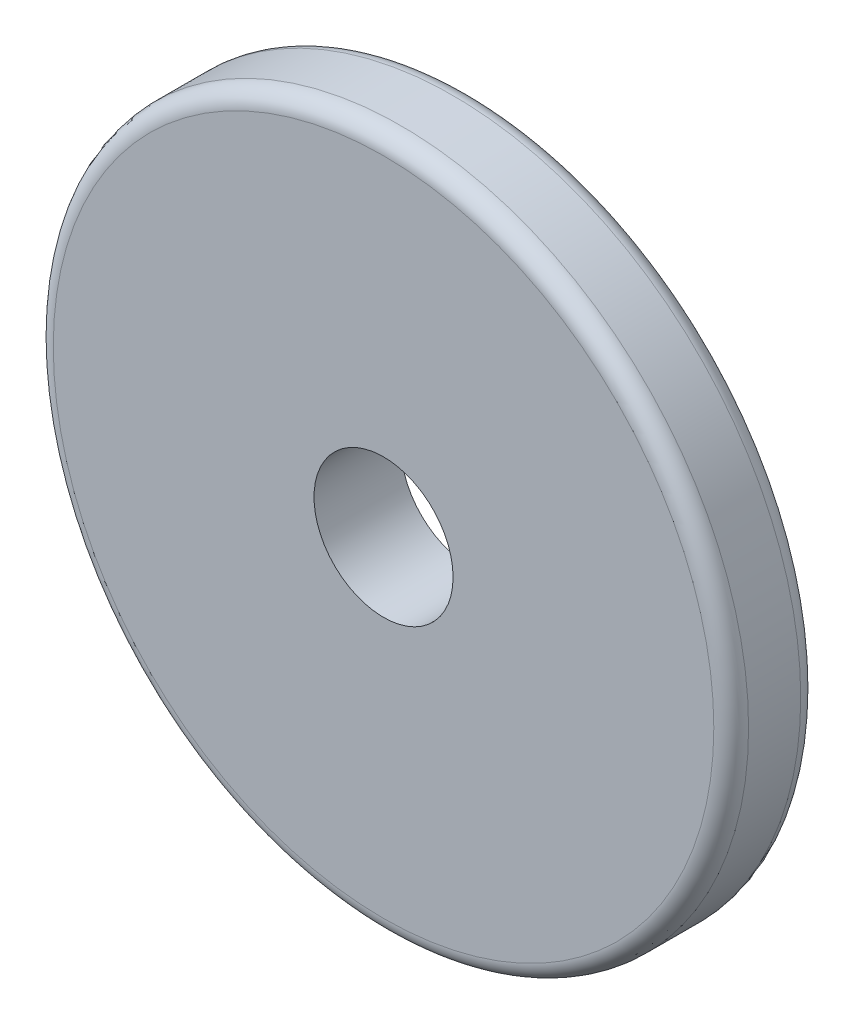
from build123d import *

# Parameters (mm, degrees)
SKETCH1_R           = 20
SKETCH1_R_2         = 4
BOSS_EXTRUDE1_DEPTH = 5
FILLET1_R           = 1


with BuildPart() as part:
    # Sketch1 → Boss-Extrude1 (new body)
    with BuildSketch(Plane.XY):
        Circle(SKETCH1_R)
        Circle(SKETCH1_R_2, mode=Mode.SUBTRACT)
    extrude(amount=BOSS_EXTRUDE1_DEPTH)

    # Fillet1
    fillet1_edges = [part.edges().sort_by_distance(p)[0] for p in [
        (-20, 0, 0),
        (-20, 0, 5),
    ]]
    fillet(fillet1_edges, radius=FILLET1_R)


solid = part.part
